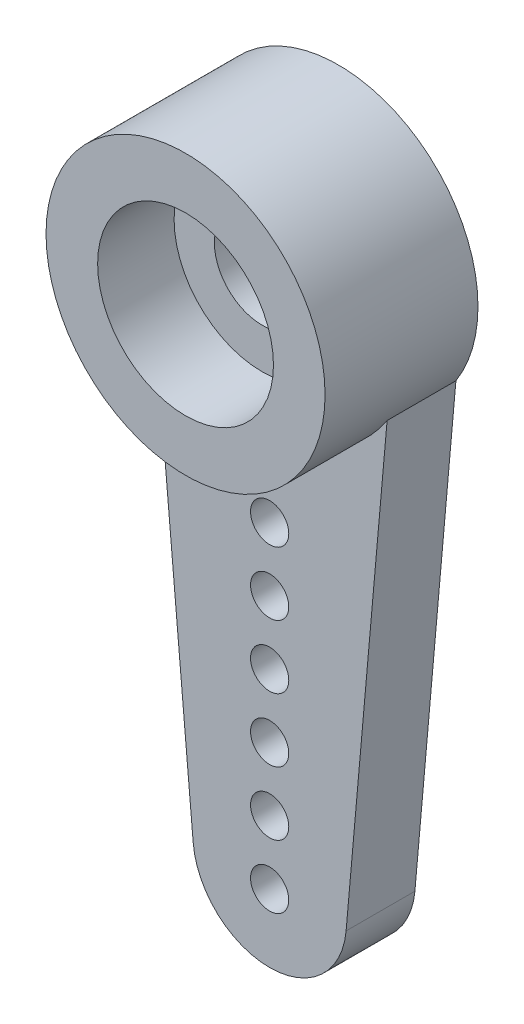
from build123d import *

# Parameters (mm, degrees)
RESSALTO_EXTRUS_O1_DEPTH  = 1.8
ESBO_O2_R                 = 3.65
ESBO_O2_R_2               = 1.245
RESSALTO_EXTRUS_O2_DEPTH  = 4
CORTE_EXTRUS_O1_START     = -2
ESBO_O3_R                 = 2.3
ESBO_O3_R_2               = 1.245
CORTE_EXTRUS_O1_DEPTH     = 2
FURO_COM_FOLGA_DE_00001_D = 0.899999978
FURO_COM_FOLGA_DE_00002_D = 1.000000032


with BuildPart() as part:
    # Esboço1 → Ressalto-extrusão1 (new body)
    with BuildSketch(Plane.XY):
        with BuildLine():
            Line((2, 8.197608696), (3.072718666, 20.297608696))
            ThreePointArc((3.072718666, 20.297608696), (0, 18.617608696), (-3.072718666, 20.297608696))
            Line((-3.072718666, 20.297608696), (-2, 8.197608696))
            ThreePointArc((-2, 8.197608696), (0, 6.36707334), (2, 8.197608696))
        make_face()
    extrude(amount=RESSALTO_EXTRUS_O1_DEPTH)

    # Esboço2 → Ressalto-extrusão2 (add)
    with BuildSketch(Plane(origin=(0, 0, 0), x_dir=(-1, 0, 0), z_dir=(0, 0, -1))):
        with Locations((0, 22.267608696)):
            Circle(ESBO_O2_R)
        with Locations((0, 22.267608696)):
            Circle(ESBO_O2_R_2, mode=Mode.SUBTRACT)
    extrude(amount=-RESSALTO_EXTRUS_O2_DEPTH)

    # Esboço3 → Corte-extrusão1 (cut)
    with BuildSketch(Plane.XY.offset(4).offset(CORTE_EXTRUS_O1_START)):
        with Locations((0, 22.267608696)):
            Circle(ESBO_O3_R)
        with Locations(Location((0, 22.267608696, 0), (0, 0, 180))):
            Circle(ESBO_O3_R_2, mode=Mode.SUBTRACT)
    extrude(amount=CORTE_EXTRUS_O1_DEPTH, mode=Mode.SUBTRACT)

    # Furo com folga de #00001 (through all)
    with Locations(Plane.XY.offset(1.8)):
        with Locations((0, 8.14707334)):
            Hole(FURO_COM_FOLGA_DE_00001_D / 2)

    # Furo com folga de #00002 (through all)
    with Locations(Plane.XY.offset(1.8)):
        with Locations((0, 8.14707334), (0, 9.807341018), (0, 11.467608696), (0, 13.127876373), (0, 14.788144051), (0, 16.448411729)):
            Hole(FURO_COM_FOLGA_DE_00002_D / 2)


solid = part.part
